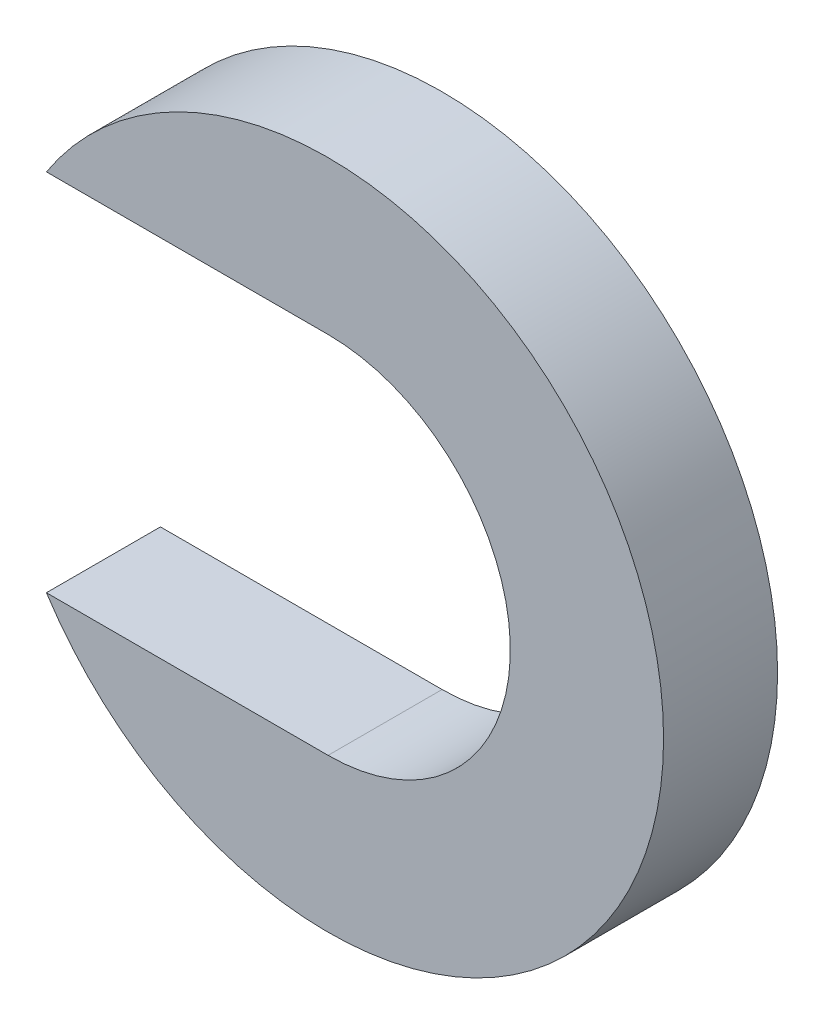
from build123d import *

# Parameters (mm, degrees)
BOSS_EXTRUDE1_DEPTH = 3.0988


with BuildPart() as part:
    # Sketch1 → Boss-Extrude1 (new body)
    with BuildSketch(Plane.XY):
        with BuildLine():
            Line((0, 4.953), (-7.656151576, 4.953))
            ThreePointArc((-7.656151576, 4.953), (9.1186, 0), (-7.656151576, -4.953))
            Line((-7.656151576, -4.953), (0, -4.953))
            ThreePointArc((0, -4.953), (4.953, 0), (0, 4.953))
        make_face()
    extrude(amount=BOSS_EXTRUDE1_DEPTH)


solid = part.part
